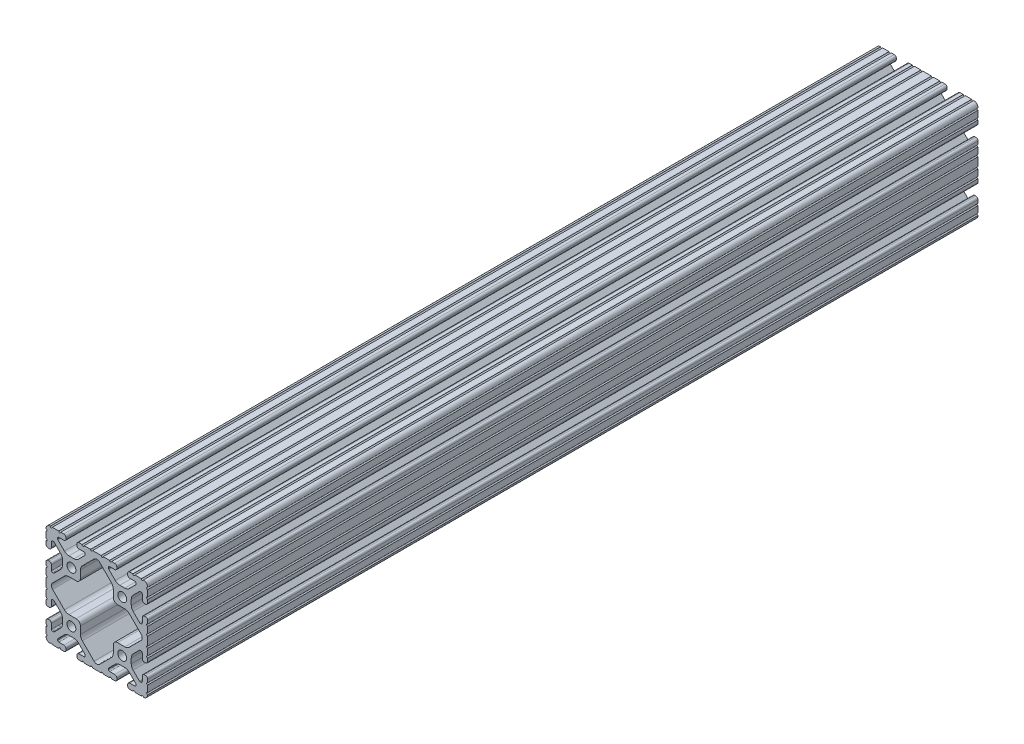
from build123d import *

# Parameters (mm, degrees)
SKETCH1_R           = 3.3274
BOSS_EXTRUDE1_DEPTH = 622.3


with BuildPart() as part:
    # Sketch1 → Boss-Extrude1 (new body)
    with BuildSketch(Plane.XY):
        with BuildLine():
            Line((-38.1, 3.2004), (-38.1, -3.2004))
            ThreePointArc((-38.1, -3.2004), (-37.338, -3.9624), (-38.1, -4.7244))
            Line((-38.1, -4.7244), (-38.1, -9.5504))
            ThreePointArc((-38.1, -9.5504), (-37.338, -10.3124), (-38.1, -11.0744))
            Line((-38.1, -11.0744), (-38.1, -13.4112))
            ThreePointArc((-38.1, -13.4112), (-37.638751759, -14.524751759), (-36.5252, -14.986))
            Line((-36.5252, -14.986), (-35.6108, -14.986))
            ThreePointArc((-35.6108, -14.986), (-34.497248241, -14.524751759), (-34.036, -13.4112))
            Line((-34.036, -13.4112), (-34.036, -9.652))
            ThreePointArc((-34.036, -9.652), (-33.775617928, -9.023382072), (-33.147, -8.763))
            Line((-33.147, -8.763), (-32.578918, -8.763))
            ThreePointArc((-32.578918, -8.763), (-32.238712428, -8.830671096), (-31.950300071, -9.023382072))
            Line((-31.950300071, -9.023382072), (-27.179198975, -13.794483168))
            ThreePointArc((-27.179198975, -13.794483168), (-26.14957176, -15.33542919), (-25.788014764, -17.153098957))
            Line((-25.788014764, -17.153098957), (-25.788014764, -20.946901043))
            ThreePointArc((-25.788014764, -20.946901043), (-26.14957176, -22.76457081), (-27.179198975, -24.305516832))
            Line((-27.179198975, -24.305516832), (-31.950300071, -29.076617928))
            ThreePointArc((-31.950300071, -29.076617928), (-32.238712428, -29.269328904), (-32.578918, -29.337))
            Line((-32.578918, -29.337), (-33.147, -29.337))
            ThreePointArc((-33.147, -29.337), (-33.775617928, -29.076617928), (-34.036, -28.448))
            Line((-34.036, -28.448), (-34.036, -24.6888))
            ThreePointArc((-34.036, -24.6888), (-34.497248241, -23.575248241), (-35.6108, -23.114))
            Line((-35.6108, -23.114), (-36.5252, -23.114))
            ThreePointArc((-36.5252, -23.114), (-37.638751759, -23.575248241), (-38.1, -24.6888))
            Line((-38.1, -24.6888), (-38.1, -27.0256))
            ThreePointArc((-38.1, -27.0256), (-37.338, -27.7876), (-38.1, -28.5496))
            Line((-38.1, -28.5496), (-38.1, -33.3756))
            ThreePointArc((-38.1, -33.3756), (-37.338, -34.1376), (-38.1, -34.8996))
            Line((-38.1, -34.8996), (-38.1, -34.925))
            ThreePointArc((-38.1, -34.925), (-37.17006403, -37.17006403), (-34.925, -38.1))
            Line((-34.925, -38.1), (-34.8996, -38.1))
            ThreePointArc((-34.8996, -38.1), (-34.1376, -37.338), (-33.3756, -38.1))
            Line((-33.3756, -38.1), (-28.5496, -38.1))
            ThreePointArc((-28.5496, -38.1), (-27.7876, -37.338), (-27.0256, -38.1))
            Line((-27.0256, -38.1), (-24.6888, -38.1))
            ThreePointArc((-24.6888, -38.1), (-23.575248241, -37.638751759), (-23.114, -36.5252))
            Line((-23.114, -36.5252), (-23.114, -35.6108))
            ThreePointArc((-23.114, -35.6108), (-23.575248241, -34.497248241), (-24.6888, -34.036))
            Line((-24.6888, -34.036), (-28.448, -34.036))
            ThreePointArc((-28.448, -34.036), (-29.076617928, -33.775617928), (-29.337, -33.147))
            Line((-29.337, -33.147), (-29.337, -32.578918))
            ThreePointArc((-29.337, -32.578918), (-29.269328904, -32.238712428), (-29.076617928, -31.950300071))
            Line((-29.076617928, -31.950300071), (-24.305516832, -27.179198975))
            ThreePointArc((-24.305516832, -27.179198975), (-22.76457081, -26.14957176), (-20.946901043, -25.788014764))
            Line((-20.946901043, -25.788014764), (-17.153098957, -25.788014764))
            ThreePointArc((-17.153098957, -25.788014764), (-15.33542919, -26.14957176), (-13.794483168, -27.179198975))
            Line((-13.794483168, -27.179198975), (-9.023382072, -31.950300071))
            ThreePointArc((-9.023382072, -31.950300071), (-8.830671096, -32.238712428), (-8.763, -32.578918))
            Line((-8.763, -32.578918), (-8.763, -33.147))
            ThreePointArc((-8.763, -33.147), (-9.023382072, -33.775617928), (-9.652, -34.036))
            Line((-9.652, -34.036), (-13.4112, -34.036))
            ThreePointArc((-13.4112, -34.036), (-14.524751759, -34.497248241), (-14.986, -35.6108))
            Line((-14.986, -35.6108), (-14.986, -36.5252))
            ThreePointArc((-14.986, -36.5252), (-14.524751759, -37.638751759), (-13.4112, -38.1))
            Line((-13.4112, -38.1), (-11.0744, -38.1))
            ThreePointArc((-11.0744, -38.1), (-10.3124, -37.338), (-9.5504, -38.1))
            Line((-9.5504, -38.1), (-4.7244, -38.1))
            ThreePointArc((-4.7244, -38.1), (-3.9624, -37.338), (-3.2004, -38.1))
            Line((-3.2004, -38.1), (3.2004, -38.1))
            ThreePointArc((3.2004, -38.1), (3.9624, -37.338), (4.7244, -38.1))
            Line((4.7244, -38.1), (9.5504, -38.1))
            ThreePointArc((9.5504, -38.1), (10.3124, -37.338), (11.0744, -38.1))
            Line((11.0744, -38.1), (13.4112, -38.1))
            ThreePointArc((13.4112, -38.1), (14.524751759, -37.638751759), (14.986, -36.5252))
            Line((14.986, -36.5252), (14.986, -35.6108))
            ThreePointArc((14.986, -35.6108), (14.524751759, -34.497248241), (13.4112, -34.036))
            Line((13.4112, -34.036), (9.652, -34.036))
            ThreePointArc((9.652, -34.036), (9.023382072, -33.775617928), (8.763, -33.147))
            Line((8.763, -33.147), (8.763, -32.578918))
            ThreePointArc((8.763, -32.578918), (8.830671096, -32.238712428), (9.023382072, -31.950300071))
            Line((9.023382072, -31.950300071), (13.794483168, -27.179198975))
            ThreePointArc((13.794483168, -27.179198975), (15.33542919, -26.14957176), (17.153098957, -25.788014764))
            Line((17.153098957, -25.788014764), (20.946901043, -25.788014764))
            ThreePointArc((20.946901043, -25.788014764), (22.76457081, -26.14957176), (24.305516832, -27.179198975))
            Line((24.305516832, -27.179198975), (29.076617928, -31.950300071))
            ThreePointArc((29.076617928, -31.950300071), (29.269328904, -32.238712428), (29.337, -32.578918))
            Line((29.337, -32.578918), (29.337, -33.147))
            ThreePointArc((29.337, -33.147), (29.076617928, -33.775617928), (28.448, -34.036))
            Line((28.448, -34.036), (24.6888, -34.036))
            ThreePointArc((24.6888, -34.036), (23.575248241, -34.497248241), (23.114, -35.6108))
            Line((23.114, -35.6108), (23.114, -36.5252))
            ThreePointArc((23.114, -36.5252), (23.575248241, -37.638751759), (24.6888, -38.1))
            Line((24.6888, -38.1), (27.0256, -38.1))
            ThreePointArc((27.0256, -38.1), (27.7876, -37.338), (28.5496, -38.1))
            Line((28.5496, -38.1), (33.3756, -38.1))
            ThreePointArc((33.3756, -38.1), (34.1376, -37.338), (34.8996, -38.1))
            Line((34.8996, -38.1), (34.925, -38.1))
            ThreePointArc((34.925, -38.1), (37.17006403, -37.17006403), (38.1, -34.925))
            Line((38.1, -34.925), (38.1, -34.8996))
            ThreePointArc((38.1, -34.8996), (37.338, -34.1376), (38.1, -33.3756))
            Line((38.1, -33.3756), (38.1, -28.5496))
            ThreePointArc((38.1, -28.5496), (37.338, -27.7876), (38.1, -27.0256))
            Line((38.1, -27.0256), (38.1, -24.6888))
            ThreePointArc((38.1, -24.6888), (37.638751759, -23.575248241), (36.5252, -23.114))
            Line((36.5252, -23.114), (35.6108, -23.114))
            ThreePointArc((35.6108, -23.114), (34.497248241, -23.575248241), (34.036, -24.6888))
            Line((34.036, -24.6888), (34.036, -28.448))
            ThreePointArc((34.036, -28.448), (33.775617928, -29.076617928), (33.147, -29.337))
            Line((33.147, -29.337), (32.578918, -29.337))
            ThreePointArc((32.578918, -29.337), (32.238712428, -29.269328904), (31.950300071, -29.076617928))
            Line((31.950300071, -29.076617928), (27.179198975, -24.305516832))
            ThreePointArc((27.179198975, -24.305516832), (26.14957176, -22.76457081), (25.788014764, -20.946901043))
            Line((25.788014764, -20.946901043), (25.788014764, -17.153098957))
            ThreePointArc((25.788014764, -17.153098957), (26.14957176, -15.33542919), (27.179198975, -13.794483168))
            Line((27.179198975, -13.794483168), (31.950300071, -9.023382072))
            ThreePointArc((31.950300071, -9.023382072), (32.238712428, -8.830671096), (32.578918, -8.763))
            Line((32.578918, -8.763), (33.147, -8.763))
            ThreePointArc((33.147, -8.763), (33.775617928, -9.023382072), (34.036, -9.652))
            Line((34.036, -9.652), (34.036, -13.4112))
            ThreePointArc((34.036, -13.4112), (34.497248241, -14.524751759), (35.6108, -14.986))
            Line((35.6108, -14.986), (36.5252, -14.986))
            ThreePointArc((36.5252, -14.986), (37.638751759, -14.524751759), (38.1, -13.4112))
            Line((38.1, -13.4112), (38.1, -11.0744))
            ThreePointArc((38.1, -11.0744), (37.338, -10.3124), (38.1, -9.5504))
            Line((38.1, -9.5504), (38.1, -4.7244))
            ThreePointArc((38.1, -4.7244), (37.338, -3.9624), (38.1, -3.2004))
            Line((38.1, -3.2004), (38.1, 3.2004))
            ThreePointArc((38.1, 3.2004), (37.338, 3.9624), (38.1, 4.7244))
            Line((38.1, 4.7244), (38.1, 9.5504))
            ThreePointArc((38.1, 9.5504), (37.338, 10.3124), (38.1, 11.0744))
            Line((38.1, 11.0744), (38.1, 13.4112))
            ThreePointArc((38.1, 13.4112), (37.638751759, 14.524751759), (36.5252, 14.986))
            Line((36.5252, 14.986), (35.6108, 14.986))
            ThreePointArc((35.6108, 14.986), (34.497248241, 14.524751759), (34.036, 13.4112))
            Line((34.036, 13.4112), (34.036, 9.652))
            ThreePointArc((34.036, 9.652), (33.775617928, 9.023382072), (33.147, 8.763))
            Line((33.147, 8.763), (32.578918, 8.763))
            ThreePointArc((32.578918, 8.763), (32.238712428, 8.830671096), (31.950300071, 9.023382072))
            Line((31.950300071, 9.023382072), (27.179198975, 13.794483168))
            ThreePointArc((27.179198975, 13.794483168), (26.14957176, 15.33542919), (25.788014764, 17.153098957))
            Line((25.788014764, 17.153098957), (25.788014764, 20.946901043))
            ThreePointArc((25.788014764, 20.946901043), (26.14957176, 22.76457081), (27.179198975, 24.305516832))
            Line((27.179198975, 24.305516832), (31.950300071, 29.076617928))
            ThreePointArc((31.950300071, 29.076617928), (32.238712428, 29.269328904), (32.578918, 29.337))
            Line((32.578918, 29.337), (33.147, 29.337))
            ThreePointArc((33.147, 29.337), (33.775617928, 29.076617928), (34.036, 28.448))
            Line((34.036, 28.448), (34.036, 24.6888))
            ThreePointArc((34.036, 24.6888), (34.497248241, 23.575248241), (35.6108, 23.114))
            Line((35.6108, 23.114), (36.5252, 23.114))
            ThreePointArc((36.5252, 23.114), (37.638751759, 23.575248241), (38.1, 24.6888))
            Line((38.1, 24.6888), (38.1, 27.0256))
            ThreePointArc((38.1, 27.0256), (37.338, 27.7876), (38.1, 28.5496))
            Line((38.1, 28.5496), (38.1, 33.3756))
            ThreePointArc((38.1, 33.3756), (37.338, 34.1376), (38.1, 34.8996))
            Line((38.1, 34.8996), (38.1, 34.925))
            ThreePointArc((38.1, 34.925), (37.17006403, 37.17006403), (34.925, 38.1))
            Line((34.925, 38.1), (34.8996, 38.1))
            ThreePointArc((34.8996, 38.1), (34.1376, 37.338), (33.3756, 38.1))
            Line((33.3756, 38.1), (28.5496, 38.1))
            ThreePointArc((28.5496, 38.1), (27.7876, 37.338), (27.0256, 38.1))
            Line((27.0256, 38.1), (24.6888, 38.1))
            ThreePointArc((24.6888, 38.1), (23.575248241, 37.638751759), (23.114, 36.5252))
            Line((23.114, 36.5252), (23.114, 35.6108))
            ThreePointArc((23.114, 35.6108), (23.575248241, 34.497248241), (24.6888, 34.036))
            Line((24.6888, 34.036), (28.448, 34.036))
            ThreePointArc((28.448, 34.036), (29.076617928, 33.775617928), (29.337, 33.147))
            Line((29.337, 33.147), (29.337, 32.578918))
            ThreePointArc((29.337, 32.578918), (29.269328904, 32.238712428), (29.076617928, 31.950300071))
            Line((29.076617928, 31.950300071), (24.305516832, 27.179198975))
            ThreePointArc((24.305516832, 27.179198975), (22.76457081, 26.14957176), (20.946901043, 25.788014764))
            Line((20.946901043, 25.788014764), (17.153098957, 25.788014764))
            ThreePointArc((17.153098957, 25.788014764), (15.33542919, 26.14957176), (13.794483168, 27.179198975))
            Line((13.794483168, 27.179198975), (9.023382072, 31.950300071))
            ThreePointArc((9.023382072, 31.950300071), (8.830671096, 32.238712428), (8.763, 32.578918))
            Line((8.763, 32.578918), (8.763, 33.147))
            ThreePointArc((8.763, 33.147), (9.023382072, 33.775617928), (9.652, 34.036))
            Line((9.652, 34.036), (13.4112, 34.036))
            ThreePointArc((13.4112, 34.036), (14.524751759, 34.497248241), (14.986, 35.6108))
            Line((14.986, 35.6108), (14.986, 36.5252))
            ThreePointArc((14.986, 36.5252), (14.524751759, 37.638751759), (13.4112, 38.1))
            Line((13.4112, 38.1), (11.0744, 38.1))
            ThreePointArc((11.0744, 38.1), (10.3124, 37.338), (9.5504, 38.1))
            Line((9.5504, 38.1), (4.7244, 38.1))
            ThreePointArc((4.7244, 38.1), (3.9624, 37.338), (3.2004, 38.1))
            Line((3.2004, 38.1), (-3.2004, 38.1))
            ThreePointArc((-3.2004, 38.1), (-3.9624, 37.338), (-4.7244, 38.1))
            Line((-4.7244, 38.1), (-9.5504, 38.1))
            ThreePointArc((-9.5504, 38.1), (-10.3124, 37.338), (-11.0744, 38.1))
            Line((-11.0744, 38.1), (-13.4112, 38.1))
            ThreePointArc((-13.4112, 38.1), (-14.524751759, 37.638751759), (-14.986, 36.5252))
            Line((-14.986, 36.5252), (-14.986, 35.6108))
            ThreePointArc((-14.986, 35.6108), (-14.524751759, 34.497248241), (-13.4112, 34.036))
            Line((-13.4112, 34.036), (-9.652, 34.036))
            ThreePointArc((-9.652, 34.036), (-9.023382072, 33.775617928), (-8.763, 33.147))
            Line((-8.763, 33.147), (-8.763, 32.578918))
            ThreePointArc((-8.763, 32.578918), (-8.830671096, 32.238712428), (-9.023382072, 31.950300071))
            Line((-9.023382072, 31.950300071), (-13.794483168, 27.179198975))
            ThreePointArc((-13.794483168, 27.179198975), (-15.33542919, 26.14957176), (-17.153098957, 25.788014764))
            Line((-17.153098957, 25.788014764), (-20.946901043, 25.788014764))
            ThreePointArc((-20.946901043, 25.788014764), (-22.76457081, 26.14957176), (-24.305516832, 27.179198975))
            Line((-24.305516832, 27.179198975), (-29.076617928, 31.950300071))
            ThreePointArc((-29.076617928, 31.950300071), (-29.269328904, 32.238712428), (-29.337, 32.578918))
            Line((-29.337, 32.578918), (-29.337, 33.147))
            ThreePointArc((-29.337, 33.147), (-29.076617928, 33.775617928), (-28.448, 34.036))
            Line((-28.448, 34.036), (-24.6888, 34.036))
            ThreePointArc((-24.6888, 34.036), (-23.575248241, 34.497248241), (-23.114, 35.6108))
            Line((-23.114, 35.6108), (-23.114, 36.5252))
            ThreePointArc((-23.114, 36.5252), (-23.575248241, 37.638751759), (-24.6888, 38.1))
            Line((-24.6888, 38.1), (-27.0256, 38.1))
            ThreePointArc((-27.0256, 38.1), (-27.7876, 37.338), (-28.5496, 38.1))
            Line((-28.5496, 38.1), (-33.3756, 38.1))
            ThreePointArc((-33.3756, 38.1), (-34.1376, 37.338), (-34.8996, 38.1))
            Line((-34.8996, 38.1), (-34.925, 38.1))
            ThreePointArc((-34.925, 38.1), (-37.17006403, 37.17006403), (-38.1, 34.925))
            Line((-38.1, 34.925), (-38.1, 34.8996))
            ThreePointArc((-38.1, 34.8996), (-37.338, 34.1376), (-38.1, 33.3756))
            Line((-38.1, 33.3756), (-38.1, 28.5496))
            ThreePointArc((-38.1, 28.5496), (-37.338, 27.7876), (-38.1, 27.0256))
            Line((-38.1, 27.0256), (-38.1, 24.6888))
            ThreePointArc((-38.1, 24.6888), (-37.638751759, 23.575248241), (-36.5252, 23.114))
            Line((-36.5252, 23.114), (-35.6108, 23.114))
            ThreePointArc((-35.6108, 23.114), (-34.497248241, 23.575248241), (-34.036, 24.6888))
            Line((-34.036, 24.6888), (-34.036, 28.448))
            ThreePointArc((-34.036, 28.448), (-33.775617928, 29.076617928), (-33.147, 29.337))
            Line((-33.147, 29.337), (-32.578918, 29.337))
            ThreePointArc((-32.578918, 29.337), (-32.238712428, 29.269328904), (-31.950300071, 29.076617928))
            Line((-31.950300071, 29.076617928), (-27.179198975, 24.305516832))
            ThreePointArc((-27.179198975, 24.305516832), (-26.14957176, 22.76457081), (-25.788014764, 20.946901043))
            Line((-25.788014764, 20.946901043), (-25.788014764, 17.153098957))
            ThreePointArc((-25.788014764, 17.153098957), (-26.14957176, 15.33542919), (-27.179198975, 13.794483168))
            Line((-27.179198975, 13.794483168), (-31.950300071, 9.023382072))
            ThreePointArc((-31.950300071, 9.023382072), (-32.238712428, 8.830671096), (-32.578918, 8.763))
            Line((-32.578918, 8.763), (-33.147, 8.763))
            ThreePointArc((-33.147, 8.763), (-33.775617928, 9.023382072), (-34.036, 9.652))
            Line((-34.036, 9.652), (-34.036, 13.4112))
            ThreePointArc((-34.036, 13.4112), (-34.497248241, 14.524751759), (-35.6108, 14.986))
            Line((-35.6108, 14.986), (-36.5252, 14.986))
            ThreePointArc((-36.5252, 14.986), (-37.638751759, 14.524751759), (-38.1, 13.4112))
            Line((-38.1, 13.4112), (-38.1, 11.0744))
            ThreePointArc((-38.1, 11.0744), (-37.338, 10.3124), (-38.1, 9.5504))
            Line((-38.1, 9.5504), (-38.1, 4.7244))
            ThreePointArc((-38.1, 4.7244), (-37.338, 3.9624), (-38.1, 3.2004))
        make_face()
        with Locations((-19.05, 19.05)):
            Circle(SKETCH1_R, mode=Mode.SUBTRACT)
        with Locations((-19.05, -19.05)):
            Circle(SKETCH1_R, mode=Mode.SUBTRACT)
        with Locations((19.05, -19.05)):
            Circle(SKETCH1_R, mode=Mode.SUBTRACT)
        with Locations((19.05, 19.05)):
            Circle(SKETCH1_R, mode=Mode.SUBTRACT)
        with BuildLine():
            Line((15.48698542, 12.311985236), (20.946901043, 12.311985236))
            ThreePointArc((20.946901043, 12.311985236), (22.76457081, 11.95042824), (24.305516832, 10.920801025))
            Line((24.305516832, 10.920801025), (33.160858949, 2.065458908))
            ThreePointArc((33.160858949, 2.065458908), (34.016400041, 0), (33.160858949, -2.065458908))
            Line((33.160858949, -2.065458908), (24.305516832, -10.920801025))
            ThreePointArc((24.305516832, -10.920801025), (22.76457081, -11.95042824), (20.946901043, -12.311985236))
            Line((20.946901043, -12.311985236), (15.48698542, -12.311985236))
            ThreePointArc((15.48698542, -12.311985236), (13.24192139, -13.241921206), (12.31198542, -15.486985236))
            Line((12.31198542, -15.486985236), (12.31198542, -20.946901043))
            ThreePointArc((12.31198542, -20.946901043), (11.950428424, -22.76457081), (10.920801209, -24.305516832))
            Line((10.920801209, -24.305516832), (2.065458908, -33.160859133))
            ThreePointArc((2.065458908, -33.160859133), (0, -34.016400226), (-2.065458908, -33.160859133))
            Line((-2.065458908, -33.160859133), (-10.920801209, -24.305516832))
            ThreePointArc((-10.920801209, -24.305516832), (-11.950428424, -22.76457081), (-12.31198542, -20.946901043))
            Line((-12.31198542, -20.946901043), (-12.31198542, -15.486985236))
            ThreePointArc((-12.31198542, -15.486985236), (-13.24192139, -13.241921206), (-15.48698542, -12.311985236))
            Line((-15.48698542, -12.311985236), (-20.946901043, -12.311985236))
            ThreePointArc((-20.946901043, -12.311985236), (-22.76457081, -11.95042824), (-24.305516832, -10.920801025))
            Line((-24.305516832, -10.920801025), (-33.160858949, -2.065458908))
            ThreePointArc((-33.160858949, -2.065458908), (-34.016400041, 0), (-33.160858949, 2.065458908))
            Line((-33.160858949, 2.065458908), (-24.305516832, 10.920801025))
            ThreePointArc((-24.305516832, 10.920801025), (-22.76457081, 11.95042824), (-20.946901043, 12.311985236))
            Line((-20.946901043, 12.311985236), (-15.48698542, 12.311985236))
            ThreePointArc((-15.48698542, 12.311985236), (-13.24192139, 13.241921206), (-12.31198542, 15.486985236))
            Line((-12.31198542, 15.486985236), (-12.31198542, 20.946901043))
            ThreePointArc((-12.31198542, 20.946901043), (-11.950428424, 22.76457081), (-10.920801209, 24.305516832))
            Line((-10.920801209, 24.305516832), (-2.065458908, 33.160859133))
            ThreePointArc((-2.065458908, 33.160859133), (0, 34.016400226), (2.065458908, 33.160859133))
            Line((2.065458908, 33.160859133), (10.920801209, 24.305516832))
            ThreePointArc((10.920801209, 24.305516832), (11.950428424, 22.76457081), (12.31198542, 20.946901043))
            Line((12.31198542, 20.946901043), (12.31198542, 15.486985236))
            ThreePointArc((12.31198542, 15.486985236), (13.24192139, 13.241921206), (15.48698542, 12.311985236))
        make_face(mode=Mode.SUBTRACT)
    extrude(amount=BOSS_EXTRUDE1_DEPTH)


solid = part.part
